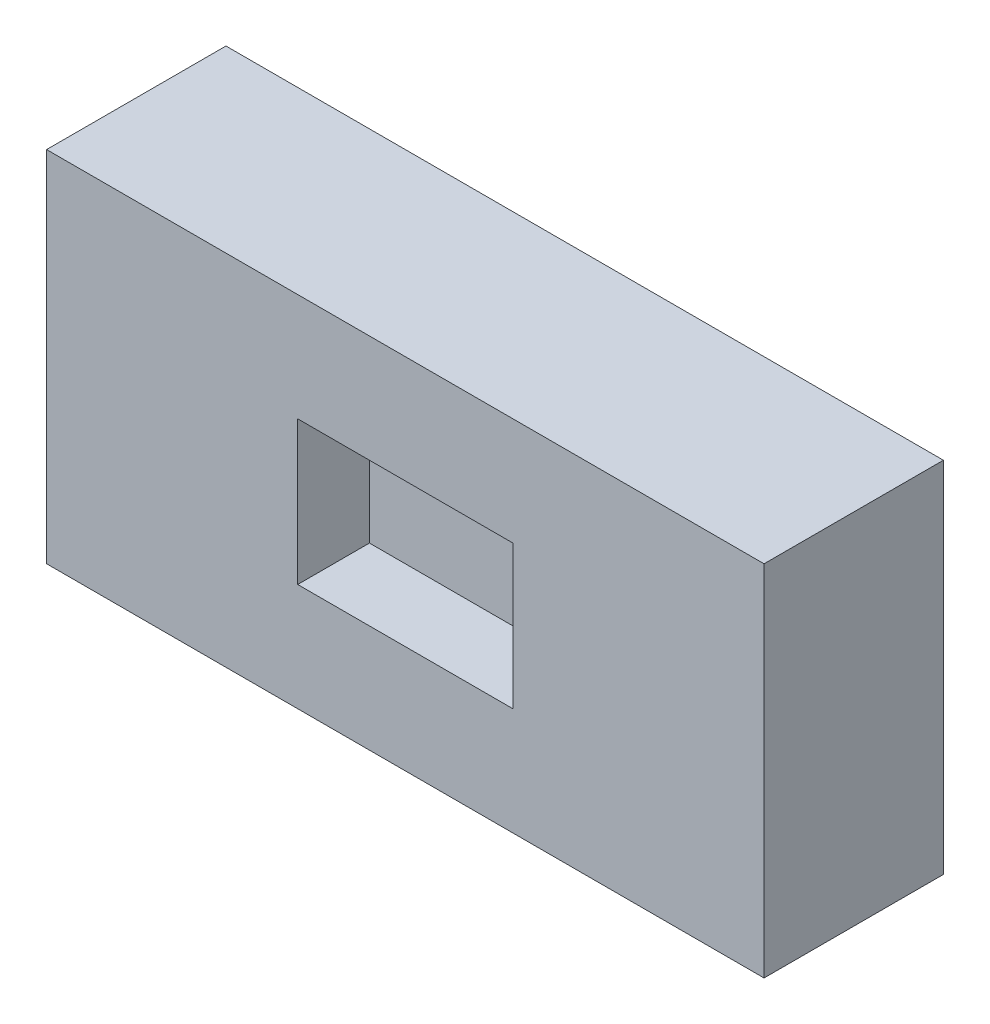
from build123d import *

# Parameters (mm, degrees)
RECTANGLESKETCH_W = 40
RECTANGLESKETCH_H = 20
BLINDBOSS_DEPTH   = 10
CUTSKETCH_W       = 12
CUTSKETCH_H       = 8
BLINDCUT_DEPTH    = 4


with BuildPart() as part:
    # RectangleSketch → BlindBoss (new body)
    with BuildSketch(Plane.XY):
        with Locations((20, 10)):
            Rectangle(RECTANGLESKETCH_W, RECTANGLESKETCH_H)
    extrude(amount=BLINDBOSS_DEPTH)

    # CutSketch → BlindCut (cut)
    with BuildSketch(Plane.XY.offset(10)):
        with Locations((20, 10)):
            Rectangle(CUTSKETCH_W, CUTSKETCH_H)
    extrude(amount=-BLINDCUT_DEPTH, mode=Mode.SUBTRACT)


solid = part.part
